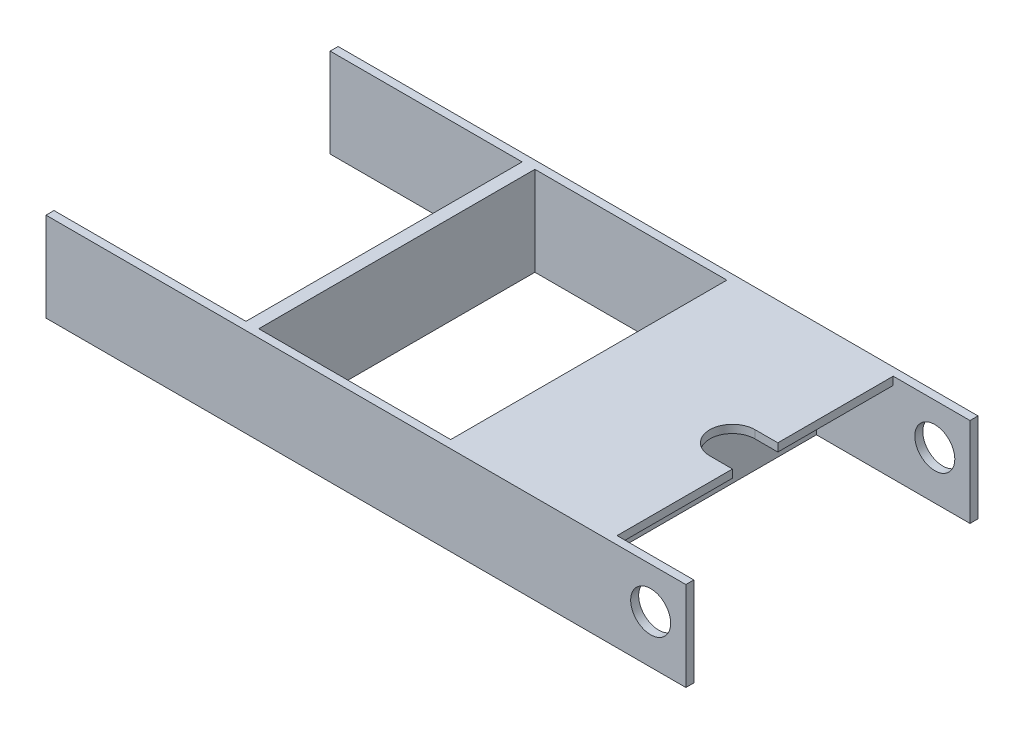
from build123d import *

# Parameters (mm, degrees)
SKETCH1_W               = 127
SKETCH1_H               = 57.9882
BOSS_EXTRUDE1_DEPTH     = 17.70126
SKETCH2_W               = 15.24
SKETCH2_H               = 54.8132
CUT_EXTRUDE1_DEPTH      = 73.015570819
CUT_EXTRUDE2_DEPTH      = 87.756115439
CUT_EXTRUDE2_DEPTH_BACK = 87.756115439
SKETCH3_R               = 3.96875
CUT_EXTRUDE5_DEPTH      = 117.808775528
CUT_EXTRUDE5_DEPTH_BACK = 15.24
SKETCH6_W               = 54.8132
SKETCH6_H               = 16.11376
CUT_EXTRUDE6_DEPTH      = 73.015570819
SKETCH7_W               = 38.1
SKETCH7_H               = 54.8132
CUT_EXTRUDE7_DEPTH      = 73.015570819
SKETCH8_W               = 38.1
SKETCH8_H               = 54.8132
CUT_EXTRUDE8_DEPTH      = 73.015570819


with BuildPart() as part:
    # Sketch1 → Boss-Extrude1 (new body)
    with BuildSketch(Plane(origin=(0, 0, 0), x_dir=(1, 0, 0), z_dir=(0, 1, 0))):
        Rectangle(SKETCH1_W, SKETCH1_H)
    extrude(amount=BOSS_EXTRUDE1_DEPTH)

    # Sketch2 → Cut-Extrude1 (cut, through all)
    with BuildSketch(Plane(origin=(0, 17.70126, 0), x_dir=(1, 0, 0), z_dir=(0, 1, 0))):
        with Locations((55.88, 0)):
            Rectangle(SKETCH2_W, SKETCH2_H)
    extrude(amount=-CUT_EXTRUDE1_DEPTH, mode=Mode.SUBTRACT)

    # Sketch3 → Cut-Extrude2 (cut, two sides: drawn at the far end of the back side and taken through both)
    with BuildSketch(Plane.XY.offset(-27.4066).offset(-CUT_EXTRUDE2_DEPTH_BACK)):
        with Locations((56.515, 9.54786)):
            Circle(SKETCH3_R)
    extrude(amount=CUT_EXTRUDE2_DEPTH + CUT_EXTRUDE2_DEPTH_BACK, mode=Mode.SUBTRACT)

    # Sketch6 → Cut-Extrude5 (cut, two sides: drawn at the far end of the back side and taken through both)
    with BuildSketch(Plane(origin=(48.26, 0, 0), x_dir=(0, 0, -1), z_dir=(1, 0, 0)).offset(-CUT_EXTRUDE5_DEPTH_BACK)):
        with Locations((0, 8.05688)):
            Rectangle(SKETCH6_W, SKETCH6_H)
    extrude(amount=CUT_EXTRUDE5_DEPTH + CUT_EXTRUDE5_DEPTH_BACK, mode=Mode.SUBTRACT)

    # Sketch4 → Cut-Extrude6 (cut, through all)
    with BuildSketch(Plane(origin=(0, 17.70126, 0), x_dir=(1, 0, 0), z_dir=(0, 1, 0))):
        with BuildLine():
            ThreePointArc((43.759999983, 4.500000017), (40.578019456, 3.181980527), (39.259999966, 0))
            Line((39.259999966, 0), (48.26, 0))
            ThreePointArc((48.26, 0), (46.94198051, 3.181980527), (43.759999983, 4.500000017))
        make_face()
        with BuildLine():
            Line((48.26, 0), (39.259999966, 0))
            ThreePointArc((39.259999966, 0), (40.578019456, -3.181980527), (43.759999983, -4.500000017))
            ThreePointArc((43.759999983, -4.500000017), (46.94198051, -3.181980527), (48.26, 0))
        make_face()
        with BuildLine():
            ThreePointArc((43.759999983, 4.500000017), (46.94198051, 3.181980527), (48.26, 0))
            Line((48.26, 0), (48.26, 4.500000017))
            Line((48.26, 4.500000017), (43.759999983, 4.500000017))
        make_face()
        with BuildLine():
            Line((48.26, -4.500000017), (48.26, 0))
            ThreePointArc((48.26, 0), (46.94198051, -3.181980527), (43.759999983, -4.500000017))
            Line((43.759999983, -4.500000017), (48.26, -4.500000017))
        make_face()
    extrude(amount=-CUT_EXTRUDE6_DEPTH, mode=Mode.SUBTRACT)

    # Sketch7 → Cut-Extrude7 (cut, through all)
    with BuildSketch(Plane(origin=(0, 17.70126, 0), x_dir=(1, 0, 0), z_dir=(0, 1, 0))):
        with Locations((-44.45, 0)):
            Rectangle(SKETCH7_W, SKETCH7_H)
    extrude(amount=-CUT_EXTRUDE7_DEPTH, mode=Mode.SUBTRACT)

    # Sketch8 → Cut-Extrude8 (cut, through all)
    with BuildSketch(Plane(origin=(0, 17.70126, 0), x_dir=(1, 0, 0), z_dir=(0, 1, 0))):
        with Locations((-3.81, 0)):
            Rectangle(SKETCH8_W, SKETCH8_H)
    extrude(amount=-CUT_EXTRUDE8_DEPTH, mode=Mode.SUBTRACT)


solid = part.part
